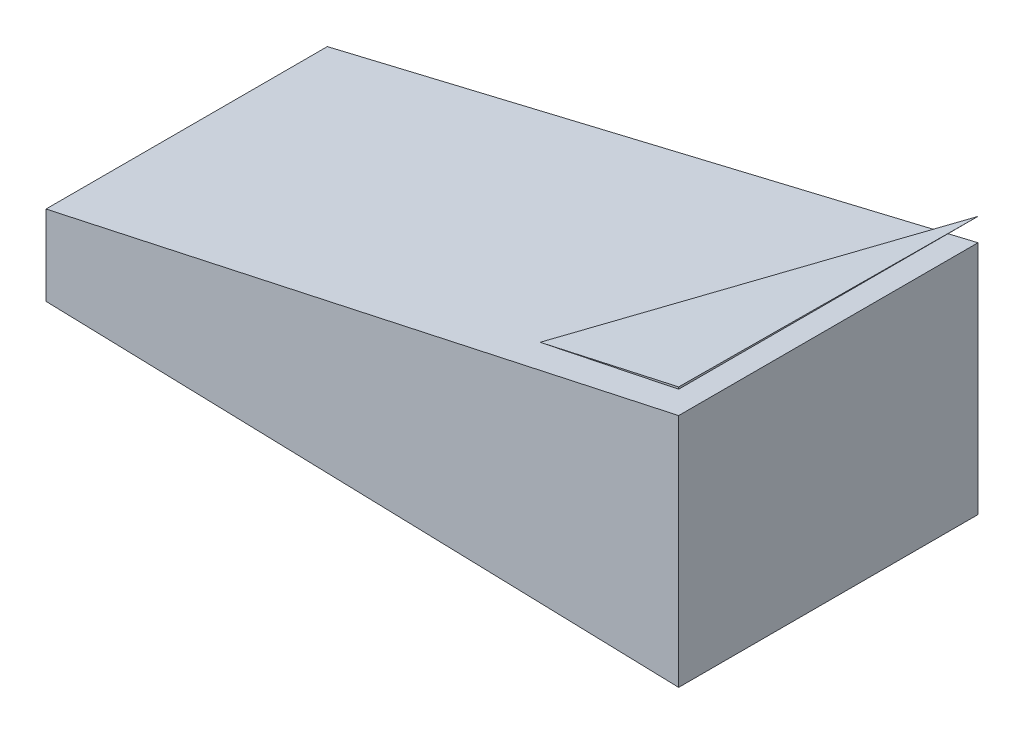
from build123d import *

# Parameters (mm, degrees)
SKETCH1_W           = 76.2
SKETCH1_H           = 50.8
BOSS_EXTRUDE1_DEPTH = 30.48
CUT_EXTRUDE2_DEPTH  = 97.52
CUT_EXTRUDE3_DEPTH  = 89.016960895
CUT_EXTRUDE7_DEPTH  = 90.244060456


with BuildPart() as part:
    # Sketch1 → Boss-Extrude1 (new body)
    with BuildSketch(Plane(origin=(0, 0, 0), x_dir=(1, 0, 0), z_dir=(0, 1, 0))):
        with Locations((38.1, 25.4)):
            Rectangle(SKETCH1_W, SKETCH1_H)
    extrude(amount=BOSS_EXTRUDE1_DEPTH)

    # Sketch3 → Cut-Extrude2 (cut, through all)
    with BuildSketch(Plane(origin=(0, 30.48, 0), x_dir=(1, 0, 0), z_dir=(0, 1, 0))):
        Polygon((0, 17.851416171), (76.2, 15.742448363), (76.2, 0), (0, 0), align=None)
    extrude(amount=-CUT_EXTRUDE2_DEPTH, mode=Mode.SUBTRACT)

    # Sketch4 → Cut-Extrude3 (cut, through all)
    with BuildSketch(Plane(origin=(0.493690887, 0, -17.837752416), x_dir=(0.9996172188458896, 0, 0.02766614875274357), z_dir=(-0.027666148752743574, 0, 0.9996172188458897))):
        Polygon((75.735299158, 30.48), (-0.493879935, 11.992043419), (-0.493879935, 30.48), align=None)
    extrude(amount=-CUT_EXTRUDE3_DEPTH, mode=Mode.SUBTRACT)

    # Sketch6 → Cut-Extrude7 (cut, through all)
    with BuildSketch(Plane(origin=(0, 0, -50.8), x_dir=(-1, 0, 0), z_dir=(0, 0, -1))):
        Polygon((0, 9.36706147), (-76.2, 27.57232113), (-76.2, 30.244767156), (-0.911909483, 13.03971689), (-0.911909483, 32.31211919), (0, 32.31211919), align=None)
    extrude(amount=-CUT_EXTRUDE7_DEPTH, mode=Mode.SUBTRACT)


with BuildPart() as cut_extrude7_piece_1:
    # of the separate pieces the step leaves, piece 1, a body of its own (cut_extrude7_pieces)
    add(part.part.solids().sort_by_distance((0, 0, -50.8))[0])


with BuildPart() as cut_extrude7_piece_2:
    # of the separate pieces the step leaves, piece 2, a body of its own (cut_extrude7_pieces)
    add(part.part.solids().sort_by_distance((76.2, 30.48, -15.742448363))[0])


solid = Compound([cut_extrude7_piece_1.part, cut_extrude7_piece_2.part])
